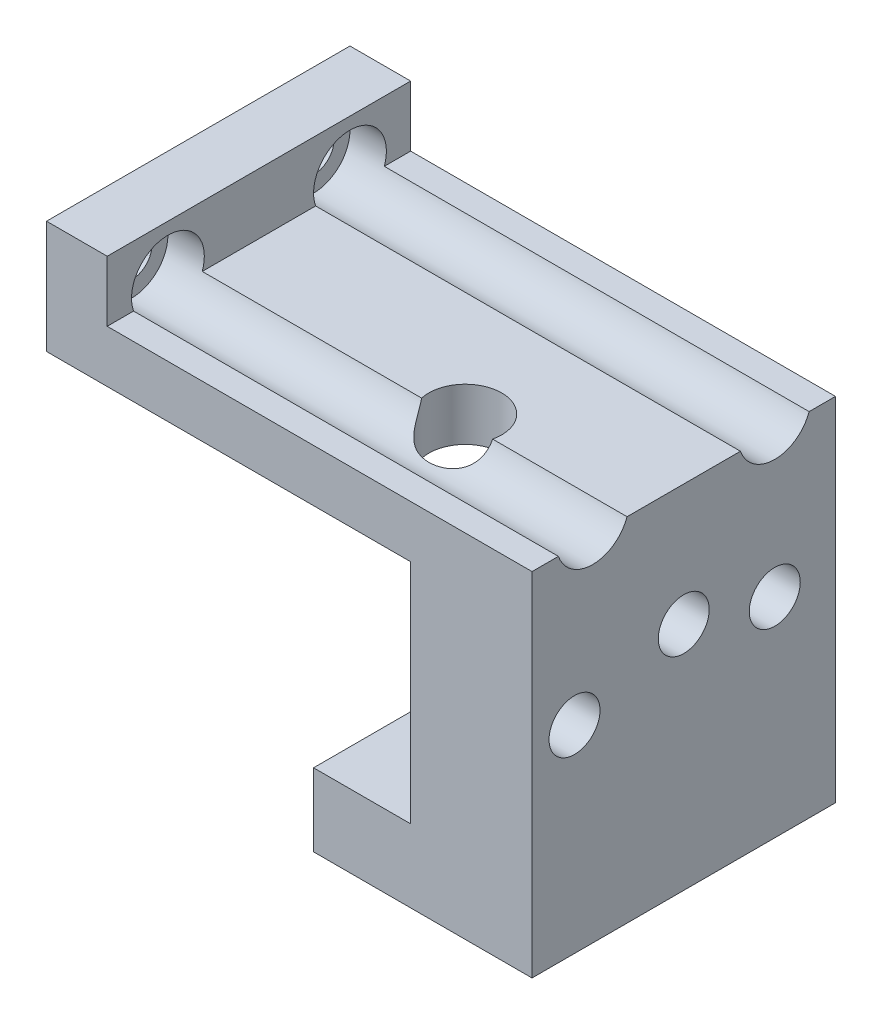
from build123d import *

# Parameters (mm, degrees)
SKETCH_1_W                = 40
SKETCH_1_H                = 34
EXTRUDE_1_DEPTH           = 12.5
HOLE_WIZARD_1_D           = 3.4
HOLE_WIZARD_1_CBORE_D     = 6
HOLE_WIZARD_1_CBORE_DEPTH = 38
SKETCH_2_W                = 35
SKETCH_2_H                = 5
CUT_EXTRUDE_1_DEPTH       = 37.249137921
HOLE_WIZARD_M2_5_1_D      = 2.05
HOLE_WIZARD_M2_5_1_DEPTH  = 6
HOLE_WIZARD_M5_1_D        = 4.2
HOLE_WIZARD_1_2_REACH     = 39.38
HOLE_WIZARD_1_2_BORE_R    = 3
HOLE_WIZARD_2_D           = 4.2


with BuildPart() as part:
    # 草图1 → 凸台-拉伸1 (new, symmetric)
    with BuildSketch(Plane.XY):
        Rectangle(SKETCH_1_W, SKETCH_1_H)
    extrude(amount=EXTRUDE_1_DEPTH, both=True)

    # Hole Wizard 1 (through all)
    with Locations(Plane(origin=(20, -11.097573199, 8.576816528), x_dir=(0, 0, -1), z_dir=(1, 0, 0))):
        with Locations((1.076816528, 24.097573199), (16.076816528, 24.097573199)):
            CounterBoreHole(HOLE_WIZARD_1_D / 2, HOLE_WIZARD_1_CBORE_D / 2, HOLE_WIZARD_1_CBORE_DEPTH)

    # 草图2 → 切除-拉伸1 (cut, through all)
    with BuildSketch(Plane.XY.offset(12.5)):
        with Locations((2.5, 14.5)):
            Rectangle(SKETCH_2_W, SKETCH_2_H)
        Polygon((-20, -17), (2, -17), (2, -11), (10, -11), (10, 7.7), (-20, 7.7), align=None)
    extrude(amount=-CUT_EXTRUDE_1_DEPTH, mode=Mode.SUBTRACT)

    # M2.5 螺纹孔1
    with Locations(Plane(origin=(23.183007196, -11, -17.133988824), x_dir=(0, 0, -1), z_dir=(0, 1, 0))):
        with Locations((-21.133988824, 17.183007196)):
            Hole(HOLE_WIZARD_M2_5_1_D / 2, depth=HOLE_WIZARD_M2_5_1_DEPTH)

    # M5 螺纹孔1 (through all)
    with Locations(Plane(origin=(20, 0, 0), x_dir=(0, 0, -1), z_dir=(1, 0, 0))):
        with Locations((0, 2), (-9, -0.7)):
            Hole(HOLE_WIZARD_M5_1_D / 2)

    # Hole Wizard 1 2 bore → Hole Wizard 1 2 (cut, up to next)
    with BuildSketch(Plane(origin=(0, 12, 0), x_dir=(1, 0, 0), z_dir=(0, 1, 0)), mode=Mode.PRIVATE) as hole_wizard_1_2_sk1:
        with Locations((6, -4)):
            Circle(HOLE_WIZARD_1_2_BORE_R)
    hole_wizard_1_2_tool1 = extrude(hole_wizard_1_2_sk1.sketch, amount=-HOLE_WIZARD_1_2_REACH, mode=Mode.PRIVATE) & part.part
    add(hole_wizard_1_2_tool1.solids().sort_by_distance((6, 12, 4))[0], mode=Mode.SUBTRACT)

    # 孔2 (through all)
    with Locations(Plane(origin=(20, 0, 0), x_dir=(0, 0, -1), z_dir=(1, 0, 0))):
        with Locations((7.5, 0.2)):
            Hole(HOLE_WIZARD_2_D / 2)


solid = part.part
